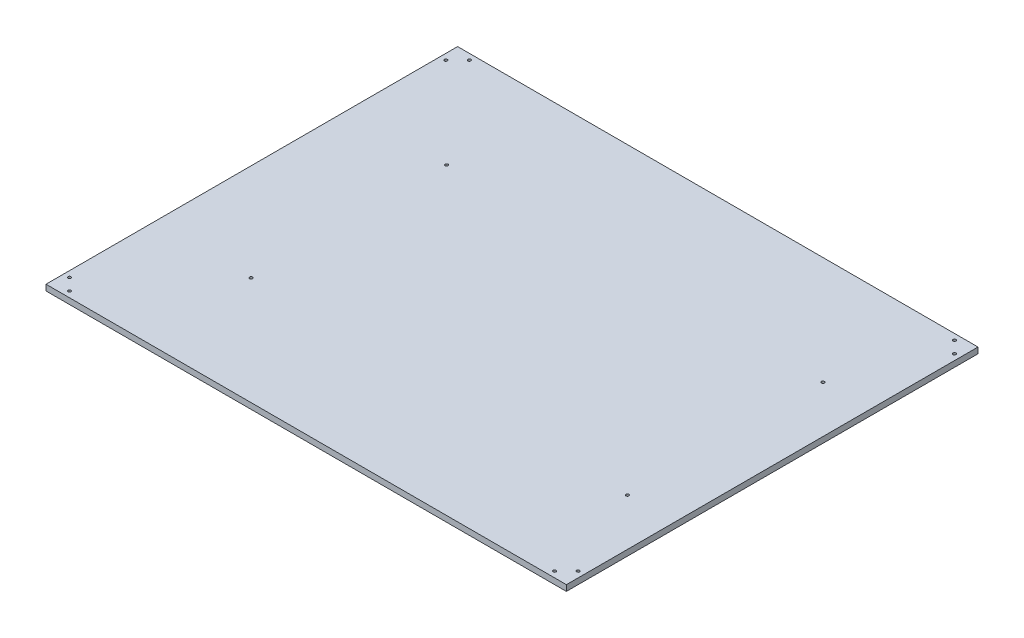
from build123d import *

# Parameters (mm, degrees)
SKETCH1_W               = 885
SKETCH1_H               = 700
BOSS_EXTRUDE1_DEPTH     = 10
SKETCH2_R               = 2.5
CUT_EXTRUDE1_DEPTH      = 10
SKETCH4_R               = 2.5
CUT_EXTRUDE2_DEPTH      = 10
MIRROR2_COPY_1_SKETCH_R = 2.5
MIRROR2_COPY_1_DEPTH    = 10


with BuildPart() as part:
    # Sketch1 → Boss-Extrude1 (new body)
    with BuildSketch(Plane(origin=(0, 0, 0), x_dir=(1, 0, 0), z_dir=(0, 1, 0))):
        with Locations((442.5, 350)):
            Rectangle(SKETCH1_W, SKETCH1_H)
    extrude(amount=BOSS_EXTRUDE1_DEPTH)

    # Sketch2 → Cut-Extrude1 (cut)
    with BuildSketch(Plane(origin=(0, 10, 0), x_dir=(1, 0, 0), z_dir=(0, 1, 0))):
        with Locations(Location((805, 183.75, 0), (0, 0, 270))):
            Circle(SKETCH2_R)
        with Locations(Location((805, 516.25, 0), (0, 0, 270))):
            Circle(SKETCH2_R)
        with Locations(Location((165, 183.75, 0), (0, 0, 270))):
            Circle(SKETCH2_R)
        with Locations(Location((165, 516.25, 0), (0, 0, 270))):
            Circle(SKETCH2_R)
    extrude(amount=-CUT_EXTRUDE1_DEPTH, mode=Mode.SUBTRACT)

    # Sketch4 → Cut-Extrude2 (cut)
    with BuildSketch(Plane(origin=(0, 10, 0), x_dir=(1, 0, 0), z_dir=(0, 1, 0))):
        with Locations(Location((875, 670, 0), (0, 0, 270))):
            Circle(SKETCH4_R)
        with Locations(Location((855, 690, 0), (0, 0, 270))):
            Circle(SKETCH4_R)
    cut_extrude2 = extrude(amount=-CUT_EXTRUDE2_DEPTH, mode=Mode.SUBTRACT)

    # Mirror1: Cut-Extrude2 across plane
    add(cut_extrude2.mirror(Plane.XY.offset(-350)), mode=Mode.SUBTRACT)

    # Mirror2: Cut-Extrude2 across plane
    add(cut_extrude2.mirror(Plane.ZY.offset(-442.5)), mode=Mode.SUBTRACT)

    # Mirror2 copy 1 sketch → Mirror2 copy 1 (cut)
    with BuildSketch(Plane(origin=(885, 10, -700), x_dir=(-1, 0, 0), z_dir=(0, 1, 0))):
        with Locations(Location((875, 670, 0), (0, 0, 270))):
            Circle(MIRROR2_COPY_1_SKETCH_R)
        with Locations(Location((855, 690, 0), (0, 0, 270))):
            Circle(MIRROR2_COPY_1_SKETCH_R)
    extrude(amount=-MIRROR2_COPY_1_DEPTH, mode=Mode.SUBTRACT)


solid = part.part
